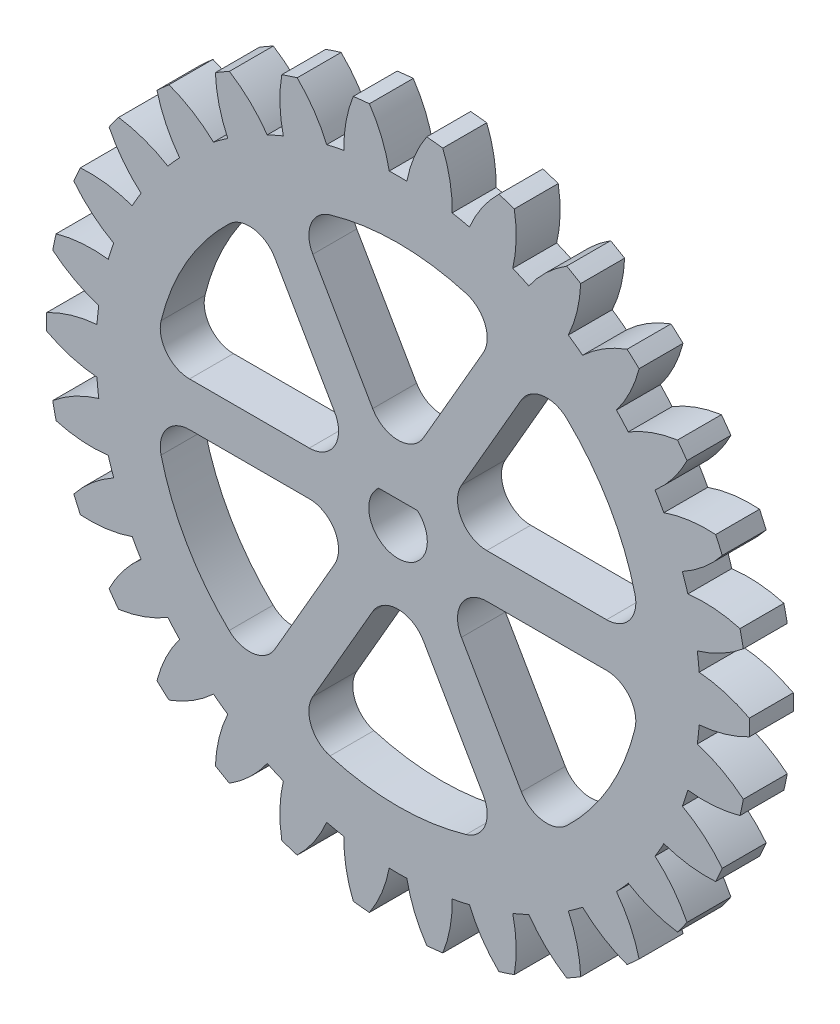
from build123d import *

# Parameters (mm, degrees)
SKETCH1_R                = 24
BOSS_EXTRUDE1_DEPTH      = 3
CUT_EXTRUDE1_START       = -3
CUT_EXTRUDE1_DEPTH       = 3
CIRPATTERN1_COUNT        = 30
CUT_EXTRUDE2_DEPTH       = 35.017143326
FILLET2_R                = 2
CIRPATTERN3_COUNT        = 6
FILLET2_OF_CIRPATTERN3_R = 2
CUT_EXTRUDE3_DEPTH       = 35.017143326


with BuildPart() as part:
    # Sketch1 → Boss-Extrude1 (new body)
    with BuildSketch(Plane.XY):
        Circle(SKETCH1_R)
    extrude(amount=BOSS_EXTRUDE1_DEPTH)

    # Sketch2 → Cut-Extrude1 (cut)
    with BuildSketch(Plane.XY.offset(3).offset(CUT_EXTRUDE1_START)):
        with BuildLine():
            ThreePointArc((1.958050038, 23.919992476), (1.114479195, 22.336043117), (0.60194016, 20.616214324))
            ThreePointArc((0.60194016, 20.616214324), (0, 20.625), (-0.60194016, 20.616214324))
            ThreePointArc((-0.60194016, 20.616214324), (-1.114479195, 22.336043117), (-1.958050038, 23.919992476))
            ThreePointArc((-1.958050038, 23.919992476), (0, 24), (1.958050038, 23.919992476))
        make_face()
    cut_extrude1 = extrude(amount=CUT_EXTRUDE1_DEPTH, mode=Mode.SUBTRACT)

    # CirPattern1: Cut-Extrude1 ×30 about axis
    cirpattern1_axis = Axis((0, 0, 3), (0, 0, 1))
    for i in range(1, CIRPATTERN1_COUNT):
        add(cut_extrude1.rotate(cirpattern1_axis, i * 360 / CIRPATTERN1_COUNT), mode=Mode.SUBTRACT)

    # Sketch3 → Cut-Extrude2 (cut, through all)
    with BuildSketch(Plane.XY.offset(3)):
        with BuildLine():
            Line((0, 3), (7, 15.124355653))
            ThreePointArc((7, 15.124355653), (0, 16.665717324), (-7, 15.124355653))
            Line((-7, 15.124355653), (0, 3))
        make_face()
    cut_extrude2 = extrude(amount=-CUT_EXTRUDE2_DEPTH, mode=Mode.SUBTRACT)

    # Fillet2
    fillet2_edges = [part.edges().sort_by_distance(p)[0] for p in [
        (-7, 15.124355653, 1.5),
        (0, 3, 1.5),
        (7, 15.124355653, 1.5),
    ]]
    fillet(fillet2_edges, radius=FILLET2_R)

    # CirPattern3: Cut-Extrude2 ×6 about axis
    cirpattern3_axis = Axis((0, 0, 0), (0, 0, 1))
    for i in range(1, CIRPATTERN3_COUNT):
        add(cut_extrude2.rotate(cirpattern3_axis, i * 360 / CIRPATTERN3_COUNT), mode=Mode.SUBTRACT)

    # Fillet2 of CirPattern3
    fillet2_of_cirpattern3_edges = [part.edges().sort_by_distance(p)[0] for p in [
        (-16.598076211, 1.5, 1.5),
        (-2.598076211, 1.5, 1.5),
        (-9.598076211, 13.624355653, 1.5),
        (-9.598076211, -13.624355653, 1.5),
        (-2.598076211, -1.5, 1.5),
        (-16.598076211, -1.5, 1.5),
        (7, -15.124355653, 1.5),
        (0, -3, 1.5),
        (-7, -15.124355653, 1.5),
        (16.598076211, -1.5, 1.5),
        (2.598076211, -1.5, 1.5),
        (9.598076211, -13.624355653, 1.5),
        (9.598076211, 13.624355653, 1.5),
        (2.598076211, 1.5, 1.5),
        (16.598076211, 1.5, 1.5),
    ]]
    fillet(fillet2_of_cirpattern3_edges, radius=FILLET2_OF_CIRPATTERN3_R)

    # Sketch4 → Cut-Extrude3 (cut, through all)
    with BuildSketch(Plane.XY.offset(3)):
        with BuildLine():
            Line((-1.322875656, 1.5), (1.322875656, 1.5))
            ThreePointArc((1.322875656, 1.5), (0, -2), (-1.322875656, 1.5))
        make_face()
    extrude(amount=-CUT_EXTRUDE3_DEPTH, mode=Mode.SUBTRACT)


solid = part.part
